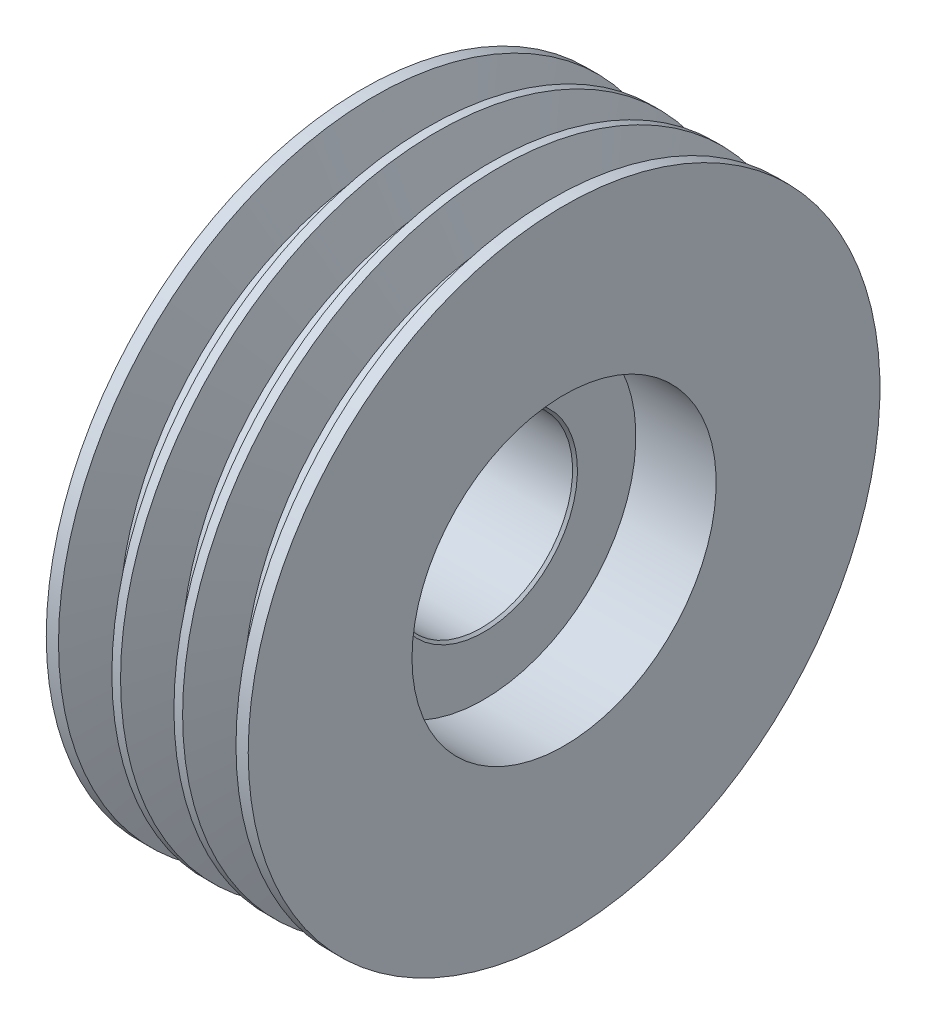
from build123d import *

# Parameters (mm, degrees)
PATTERN_LINEAR_1_COUNT = 3
PATTERN_LINEAR_1_PITCH = 25.5
CHAMFER_1_SIZE         = 1
SKETCH_4_W             = 20
SKETCH_4_H             = 6.257919358
CUT_EXTRUDE_1_DEPTH    = 202.457390036


with BuildPart() as part:
    # 草图1 → 旋转1 (revolve)
    with BuildSketch(Plane.XY, mode=Mode.PRIVATE) as revolve_1_sk:
        Polygon((0, 37.5), (0, 129.8), (83, 129.8), (83, 62.5), (50, 62.5), (50, 37.5), align=None)
    revolve(revolve_1_sk.sketch.rotate(Axis((0, 0, 0), (1, 0, 0)), 90), axis=Axis((0, 0, 0), (1, 0, 0)))

    # 草图2 → 切除-旋转1 (revolve, cut)
    with BuildSketch(Plane.XY, mode=Mode.PRIVATE) as cut_revolve_1_sk:
        Polygon((21.128051255, 110.7), (26.967507271, 129.8), (5.032492729, 129.8), (10.871948745, 110.7), align=None)
    cut_revolve_1 = revolve(cut_revolve_1_sk.sketch.rotate(Axis((0, 0, 0), (1, 0, 0)), 90), axis=Axis((0, 0, 0), (1, 0, 0)), mode=Mode.SUBTRACT)

    # 阵列(线性)1: 切除-旋转1 ×3
    with Locations(*[(i * PATTERN_LINEAR_1_PITCH, 0, 0) for i in range(1, PATTERN_LINEAR_1_COUNT)]):
        add(cut_revolve_1, mode=Mode.SUBTRACT)

    # 倒角1
    chamfer_1_edges = [part.edges().sort_by_distance(p)[0] for p in [
        (50, 0, -37.5),
        (0, 0, -37.5),
    ]]
    chamfer(chamfer_1_edges, length=CHAMFER_1_SIZE)

    # 草图4 → 切除-拉伸1 (cut, through all)
    with BuildSketch(Plane.ZY):
        with Locations((0, 39.271040416)):
            Rectangle(SKETCH_4_W, SKETCH_4_H)
    extrude(amount=-CUT_EXTRUDE_1_DEPTH, mode=Mode.SUBTRACT)


solid = part.part
